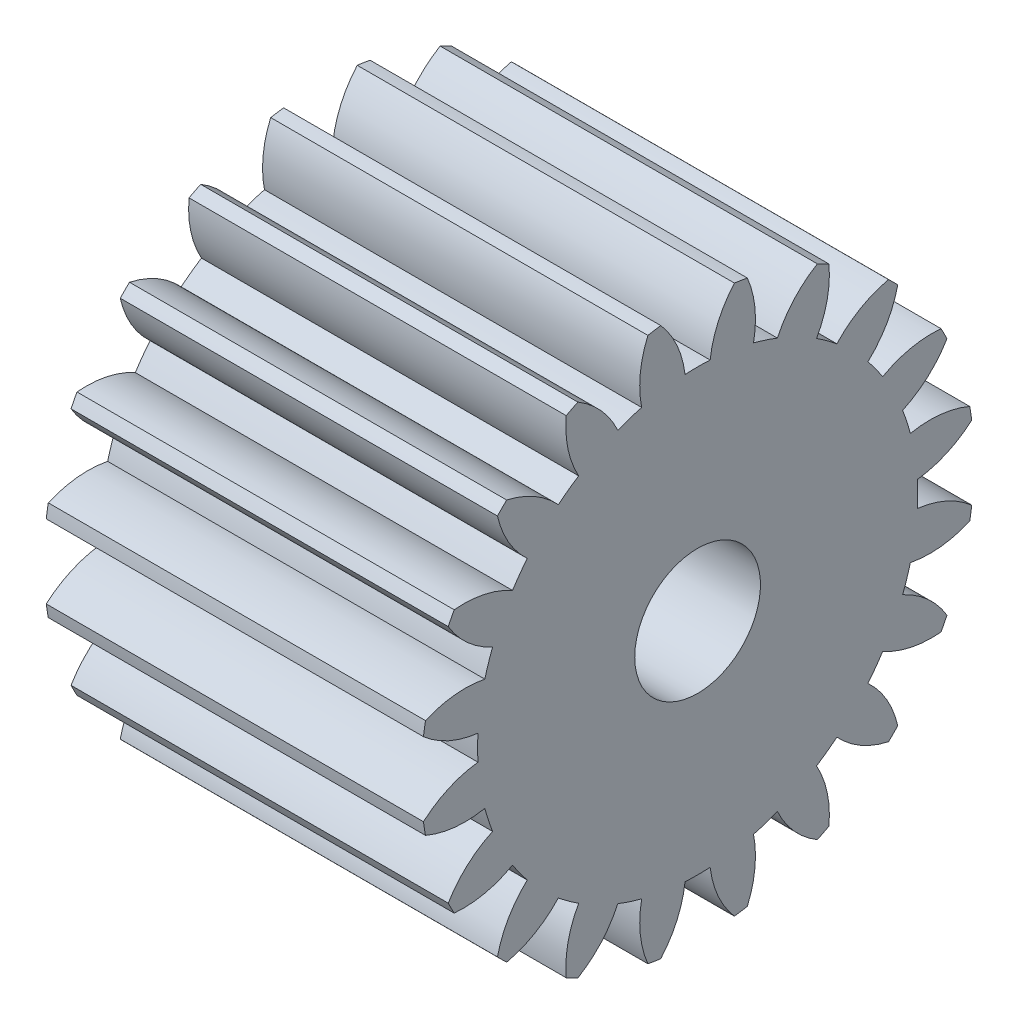
from build123d import *

# Parameters (mm, degrees)
BASPROSKE_W     = 12
BASPROSKE_H     = 8.8
TOOTHCUT_DEPTH  = 18.288146228
TEETHCUTS_COUNT = 20
TEETHCUTS_ANGLE = 342
BORSKE_R        = 2
BORE_DEPTH      = 50.0000508


with BuildPart() as part:
    # BasProSke → Base-Revolve (revolve)
    with BuildSketch(Plane(origin=(0, 0, 0), x_dir=(1, 0, 0), z_dir=(0, 1, 0)), mode=Mode.PRIVATE) as base_revolve_sk:
        with Locations((6, 4.4)):
            Rectangle(BASPROSKE_W, BASPROSKE_H)
    revolve(base_revolve_sk.sketch.rotate(Axis((-10, 0, 0), (1, 0, 0)), 180), axis=Axis((-10, 0, 0), (1, 0, 0)))

    # TooCutSke → ToothCut (cut, through all)
    with BuildSketch(Plane(origin=(0, 0, 0), x_dir=(0, 0, -1), z_dir=(1, 0, 0))):
        with BuildLine():
            ThreePointArc((0.39930266, 6.987600331), (0, 6.999), (-0.39930266, 6.987600331))
            ThreePointArc((-0.39930266, 6.987600331), (-0.659963343, 7.927158116), (-1.191466546, 8.744603629))
            ThreePointArc((-1.191466546, 8.744603629), (0, 8.8254), (1.191466546, 8.744603629))
            ThreePointArc((1.191466546, 8.744603629), (0.659963343, 7.927158116), (0.39930266, 6.987600331))
        make_face()
    toothcut = extrude(amount=TOOTHCUT_DEPTH, mode=Mode.SUBTRACT)

    # TeethCuts: ToothCut ×20 about axis
    teethcuts_axis = Axis((-10, 0, 0), (1, 0, 0))
    for i in range(1, TEETHCUTS_COUNT):
        add(toothcut.rotate(teethcuts_axis, i * TEETHCUTS_ANGLE / (TEETHCUTS_COUNT - 1)), mode=Mode.SUBTRACT)

    # BorSke → Bore (cut, symmetric)
    with BuildSketch(Plane(origin=(0, 0, 0), x_dir=(0, 0, -1), z_dir=(1, 0, 0))):
        with Locations(Location((0, 0, 0), (0, 0, 180))):
            Circle(BORSKE_R)
    extrude(amount=BORE_DEPTH, both=True, mode=Mode.SUBTRACT)


solid = part.part
